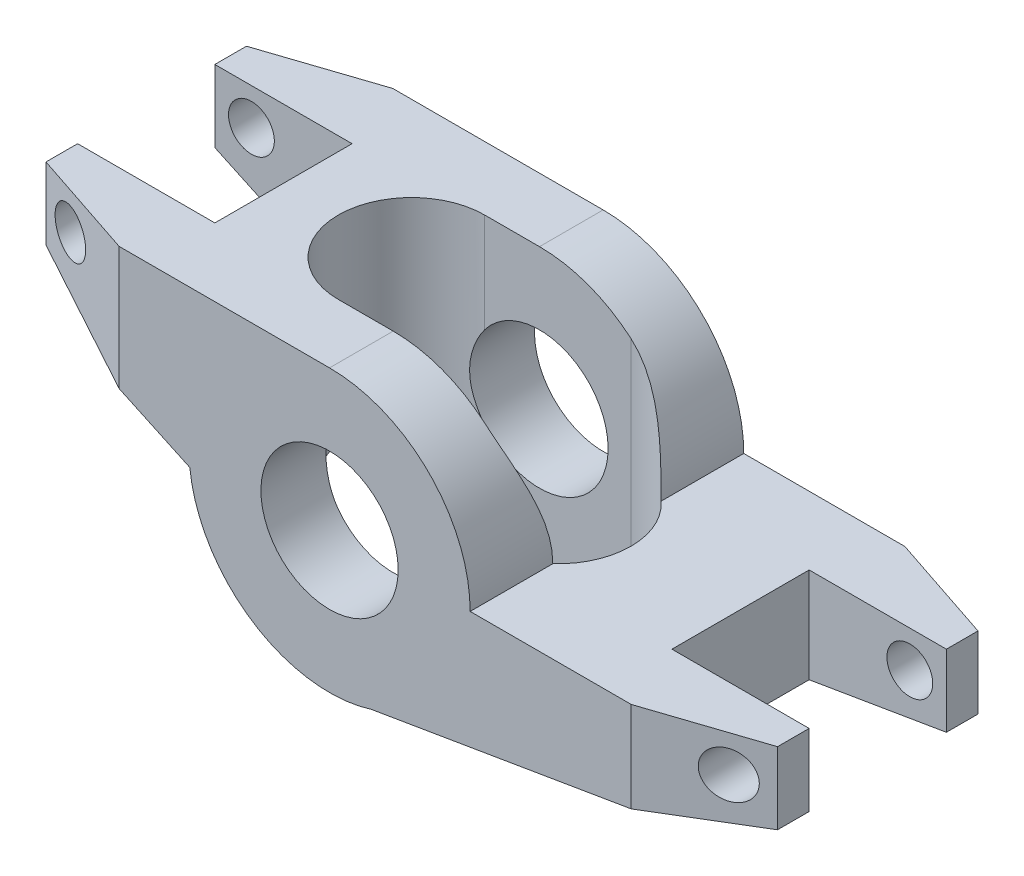
from build123d import *

# Parameters (mm, degrees)
SKETCH1_R               = 9.765
SKETCH1_R_2             = 4.765
BOSS_EXTRUDE1_DEPTH     = 9.5
CHAMFER1_SIZE           = 2.54
CHAMFER1_SIZE2          = 7.62
CHAMFER2_SIZE           = 7.62
CHAMFER2_SIZE2          = 2.54
CHAMFER3_SIZE           = 7.62
CHAMFER3_SIZE2          = 2.54
CHAMFER4_SIZE           = 2.54
CHAMFER4_SIZE2          = 7.62
CUT_EXTRUDE1_DEPTH      = 32.652016129
CUT_EXTRUDE1_DEPTH_BACK = 32.652016129
CUT_EXTRUDE2_DEPTH      = 32.652016189
CUT_EXTRUDE2_DEPTH_BACK = 32.652016189
SKETCH4_W               = 9.53
SKETCH4_H               = 9.53
CUT_EXTRUDE3_DEPTH      = 32.652016189
CUT_EXTRUDE3_DEPTH_BACK = 32.652016189
SKETCH5_R               = 1.59


with BuildPart() as part:
    # Sketch1 → Boss-Extrude1 (new, symmetric)
    # profile 1 of 3: a face of its own
    with BuildSketch(Plane.XY):
        with BuildLine():
            ThreePointArc((-9.705624325, -1.075212291), (-7.275117629, 6.513669357), (0, 9.765))
            Line((0, 9.765), (-22.23, 9.765))
            Line((-22.23, 9.765), (-22.23, 4.765))
            Line((-22.23, 4.765), (-9.705624325, -1.075212291))
        make_face()
    # profile 2 of 3: a face of its own
    with BuildSketch(Plane.XY):
        Circle(SKETCH1_R)
        Circle(SKETCH1_R_2, mode=Mode.SUBTRACT)
    # profile 3 of 3: a face of its own
    with BuildSketch(Plane.XY):
        with BuildLine():
            Line((28.57, 0), (9.765, 0))
            ThreePointArc((9.765, 0), (7.866135596, -5.786115777), (2.908034147, -9.321939841))
            Line((2.908034147, -9.321939841), (28.57, -5))
            Line((28.57, -5), (28.57, 0))
        make_face()
    extrude(amount=BOSS_EXTRUDE1_DEPTH, both=True)

    # Chamfer1
    chamfer1_edges = [part.edges().sort_by_distance(p)[0] for p in [
        (-22.23, 7.265, 9.5),
    ]]
    chamfer1_side = [part.faces().sort_by_distance(p)[0] for p in [
        (-22.23, 7.265, 0),
    ]]
    chamfer(chamfer1_edges, length=CHAMFER1_SIZE, length2=CHAMFER1_SIZE2, reference=chamfer1_side[0])

    # Chamfer2
    chamfer2_edges = [part.edges().sort_by_distance(p)[0] for p in [
        (-22.23, 7.265, -9.5),
    ]]
    chamfer2_side = [part.faces().sort_by_distance(p)[0] for p in [
        (-11.115, 9.220751812, -9.5),
    ]]
    chamfer(chamfer2_edges, length=CHAMFER2_SIZE, length2=CHAMFER2_SIZE2, reference=chamfer2_side[0])

    # Chamfer3
    chamfer3_edges = [part.edges().sort_by_distance(p)[0] for p in [
        (28.57, -2.5, 9.5),
    ]]
    chamfer3_side = [part.faces().sort_by_distance(p)[0] for p in [
        (-7.305, 9.291087213, 9.5),
    ]]
    chamfer(chamfer3_edges, length=CHAMFER3_SIZE, length2=CHAMFER3_SIZE2, reference=chamfer3_side[0])

    # Chamfer4
    chamfer4_edges = [part.edges().sort_by_distance(p)[0] for p in [
        (28.57, -2.5, -9.5),
    ]]
    chamfer4_side = [part.faces().sort_by_distance(p)[0] for p in [
        (28.57, -2.5, -1.27),
    ]]
    chamfer(chamfer4_edges, length=CHAMFER4_SIZE, length2=CHAMFER4_SIZE2, reference=chamfer4_side[0])

    # Sketch3 → Cut-Extrude1 (cut, two sides: drawn at the far end of the back side and taken through both)
    with BuildSketch(Plane(origin=(0, 0, 0), x_dir=(1, 0, 0), z_dir=(0, 1, 0)).offset(-CUT_EXTRUDE1_DEPTH_BACK)):
        with BuildLine():
            Line((-3.81, 5.08), (6.35, 5.08))
            ThreePointArc((6.35, 5.08), (11.43, 0), (6.35, -5.08))
            Line((6.35, -5.08), (-3.81, -5.08))
            ThreePointArc((-3.81, -5.08), (-8.89, 0), (-3.81, 5.08))
        make_face()
    extrude(amount=CUT_EXTRUDE1_DEPTH + CUT_EXTRUDE1_DEPTH_BACK, mode=Mode.SUBTRACT)

    # Sketch4 → Cut-Extrude2 (cut, two sides: drawn at the far end of the back side and taken through both)
    with BuildSketch(Plane(origin=(0, 0, 0), x_dir=(1, 0, 0), z_dir=(0, 1, 0)).offset(-CUT_EXTRUDE2_DEPTH_BACK)):
        with Locations((-17.465, 0)):
            Rectangle(SKETCH4_W, SKETCH4_H)
        with Locations((23.805, 0)):
            Rectangle(SKETCH4_W, SKETCH4_H)
    extrude(amount=CUT_EXTRUDE2_DEPTH + CUT_EXTRUDE2_DEPTH_BACK, mode=Mode.SUBTRACT)

    # Sketch5 → Cut-Extrude3 (cut, two sides: drawn at the far end of the back side and taken through both)
    with BuildSketch(Plane.XY.offset(-CUT_EXTRUDE3_DEPTH_BACK)):
        with Locations((26.03, -2.54)):
            Circle(SKETCH5_R)
        with Locations((-19.69, 7.225)):
            Circle(SKETCH5_R)
    extrude(amount=CUT_EXTRUDE3_DEPTH + CUT_EXTRUDE3_DEPTH_BACK, mode=Mode.SUBTRACT)


solid = part.part
